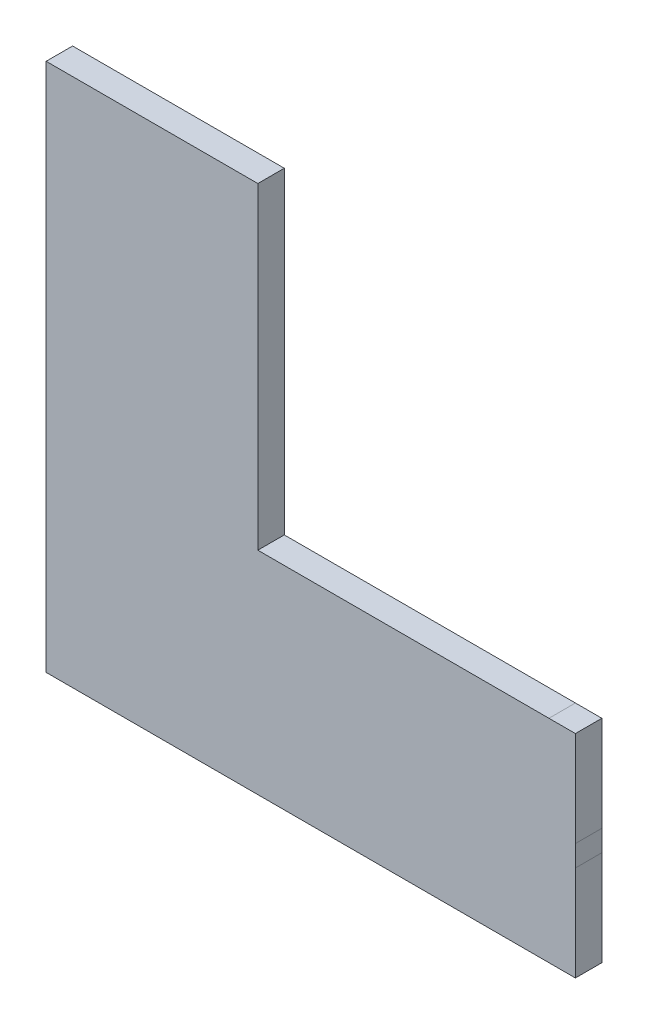
from build123d import *

# Parameters (mm, degrees)
BOSS_EXTRUDE1_DEPTH = 5


with BuildPart() as part:
    # Sketch1 → Boss-Extrude1 (new body)
    with BuildSketch(Plane.XY):
        Polygon((0, 0), (100, 0), (100, 40), (40, 40), (40, 100), (0, 100), align=None)
    extrude(amount=BOSS_EXTRUDE1_DEPTH)


solid = part.part
